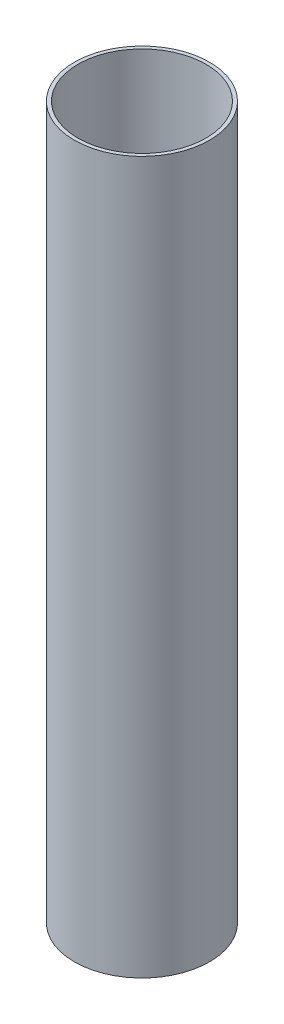
from build123d import *

# Parameters (mm, degrees)
SKETCH1_R           = 19
SKETCH1_R_2         = 18
BOSS_EXTRUDE1_DEPTH = 200


with BuildPart() as part:
    # Sketch1 → Boss-Extrude1 (new body)
    with BuildSketch(Plane(origin=(0, 0, 0), x_dir=(1, 0, 0), z_dir=(0, 1, 0))):
        with Locations(Location((0, 0, 0), (0, 0, 270))):
            Circle(SKETCH1_R)
        with Locations(Location((0, 0, 0), (0, 0, 270))):
            Circle(SKETCH1_R_2, mode=Mode.SUBTRACT)
    extrude(amount=BOSS_EXTRUDE1_DEPTH)


solid = part.part
